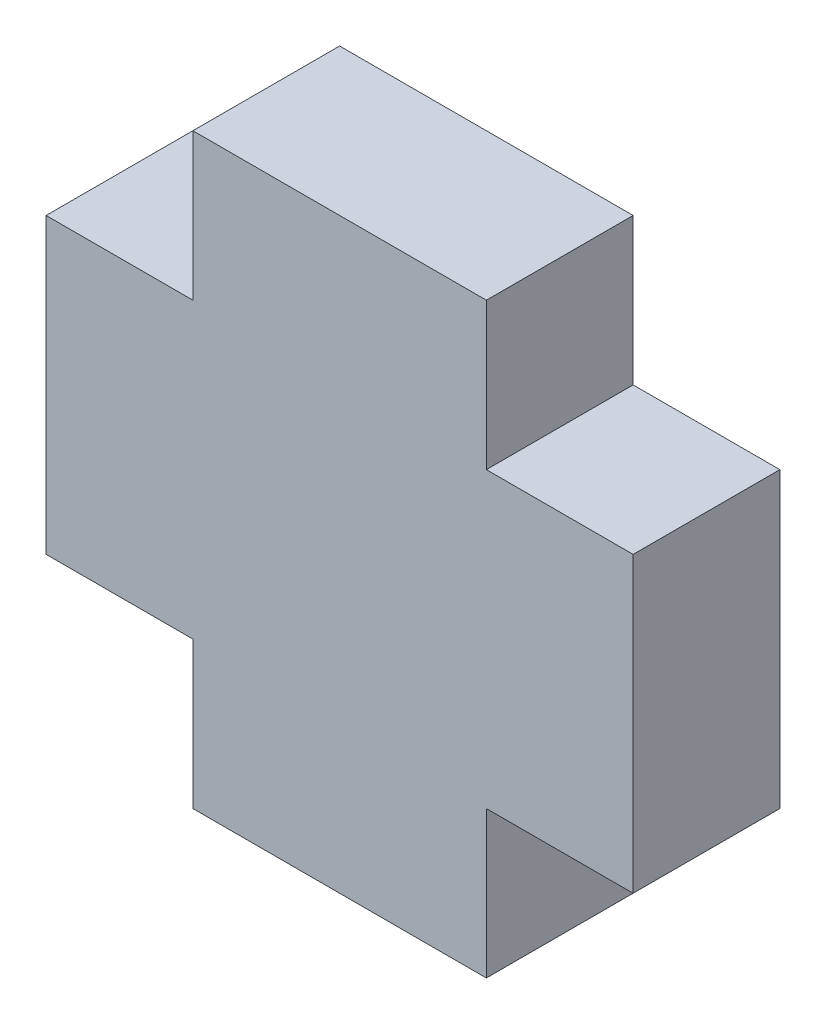
from build123d import *

# Parameters (mm, degrees)
BOSS_EXTRUDE1_DEPTH = 2.5


with BuildPart() as part:
    # Sketch1 → Boss-Extrude1 (new body)
    with BuildSketch(Plane.XY):
        Polygon((-2.5, 5), (-2.5, 2.5), (-5, 2.5), (-5, -2.5), (-2.5, -2.5), (-2.5, -5), (2.5, -5), (2.5, -2.5), (5, -2.5), (5, 2.5), (2.5, 2.5), (2.5, 5), align=None)
    extrude(amount=BOSS_EXTRUDE1_DEPTH)


solid = part.part
